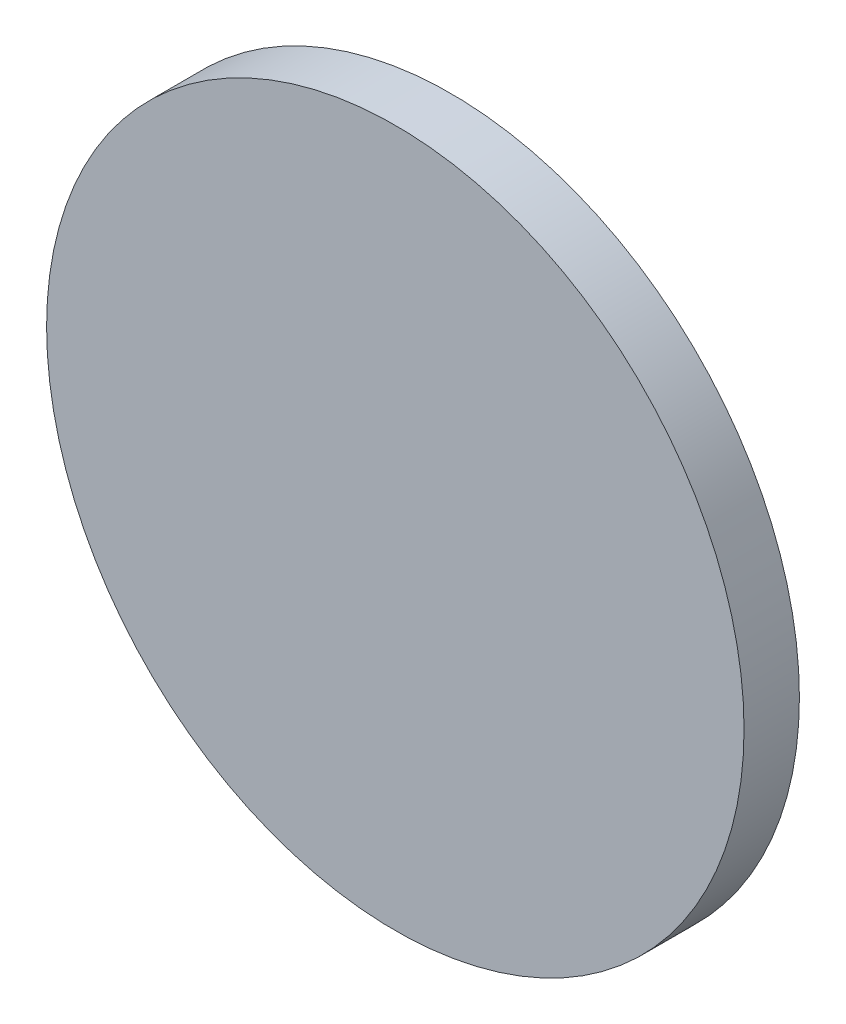
from build123d import *

# Parameters (mm, degrees)
ESBO_O1_R                = 31.5
RESSALTO_EXTRUS_O1_DEPTH = 5


with BuildPart() as part:
    # Esboço1 → Ressalto-extrusão1 (new body)
    with BuildSketch(Plane.XY):
        Circle(ESBO_O1_R)
    extrude(amount=RESSALTO_EXTRUS_O1_DEPTH)


solid = part.part
